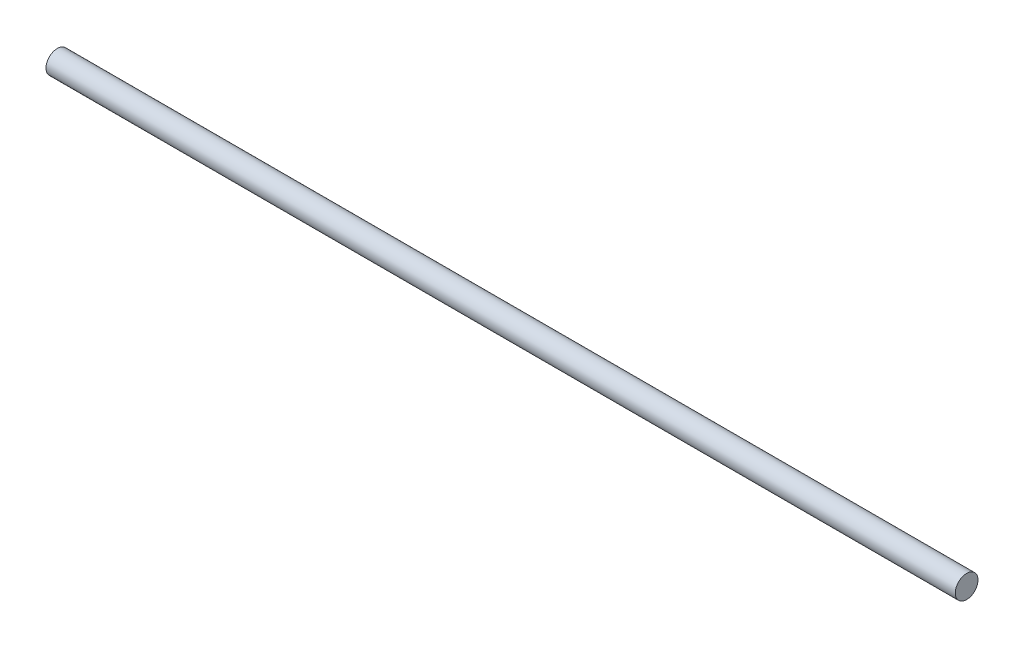
from build123d import *

# Parameters (mm, degrees)
SKETCH_1_R      = 0.5
EXTRUDE_1_DEPTH = 40


with BuildPart() as part:
    # 草图1 → 凸台-拉伸1 (new body)
    with BuildSketch(Plane(origin=(0, 0, 0), x_dir=(0, 0, -1), z_dir=(1, 0, 0))):
        Circle(SKETCH_1_R)
    extrude(amount=EXTRUDE_1_DEPTH)


solid = part.part
